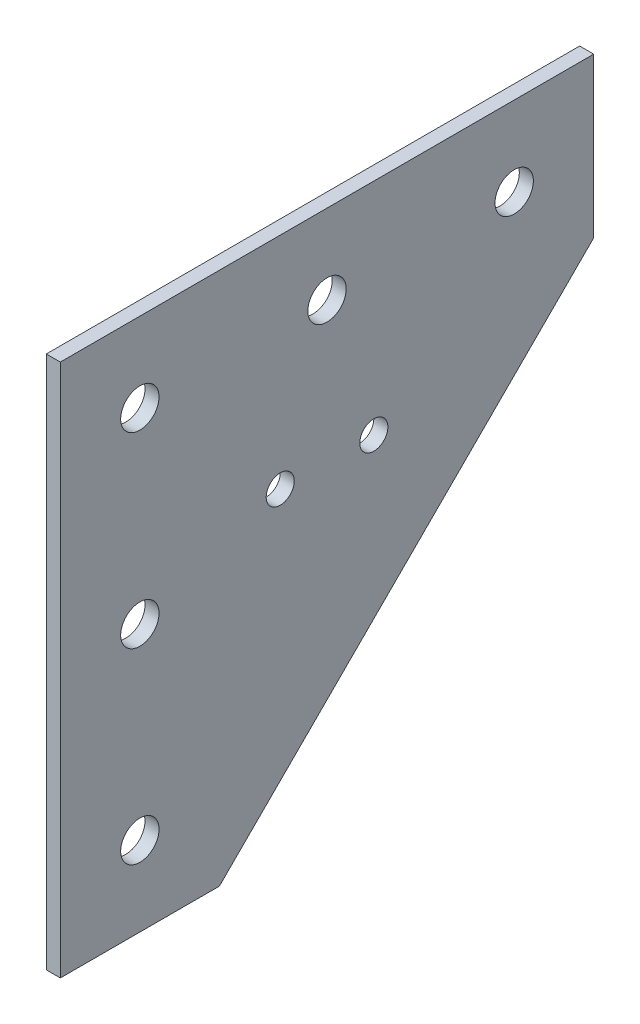
from build123d import *

# Parameters (mm, degrees)
SKETCH_1_W          = 114
SKETCH_1_H          = 114
EXTRUDE_266_DEPTH   = 3
SKETCH_2_R          = 4.1
CUT_EXTRUDE_1_DEPTH = 81.665977958
CUT_EXTRUDE_2_DEPTH = 81.665977958
SKETCH_4_R          = 3
CUT_EXTRUDE_3_DEPTH = 81.665977958


with BuildPart() as part:
    # Эскиз1 → Extrude 266 (new body)
    with BuildSketch(Plane(origin=(0, 0, 0), x_dir=(0, 0, -1), z_dir=(1, 0, 0))):
        Rectangle(SKETCH_1_W, SKETCH_1_H)
    extrude(amount=EXTRUDE_266_DEPTH)

    # Эскиз2 → Вырез-Вытянуть1 (cut, through all)
    with BuildSketch(Plane(origin=(3, 0, 0), x_dir=(0, 0, -1), z_dir=(1, 0, 0))):
        with Locations((0, 40)):
            Circle(SKETCH_2_R)
        with Locations((40, 40)):
            Circle(SKETCH_2_R)
        with Locations((-40, 0)):
            Circle(SKETCH_2_R)
        with Locations((-40, -40)):
            Circle(SKETCH_2_R)
        with Locations((-40, 40)):
            Circle(SKETCH_2_R)
    extrude(amount=-CUT_EXTRUDE_1_DEPTH, mode=Mode.SUBTRACT)

    # Эскиз3 → Вырез-Вытянуть2 (cut, through all)
    with BuildSketch(Plane(origin=(3, 0, 0), x_dir=(0, 0, -1), z_dir=(1, 0, 0))):
        Polygon((57, 23), (57, -57), (-23, -57), align=None)
    extrude(amount=-CUT_EXTRUDE_2_DEPTH, mode=Mode.SUBTRACT)

    # Эскиз4 → Вырез-Вытянуть3 (cut, through all)
    with BuildSketch(Plane(origin=(3, 0, 0), x_dir=(0, 0, -1), z_dir=(1, 0, 0))):
        with Locations((-10, 10)):
            Circle(SKETCH_4_R)
        with Locations((10, 10)):
            Circle(SKETCH_4_R)
    extrude(amount=-CUT_EXTRUDE_3_DEPTH, mode=Mode.SUBTRACT)


solid = part.part
